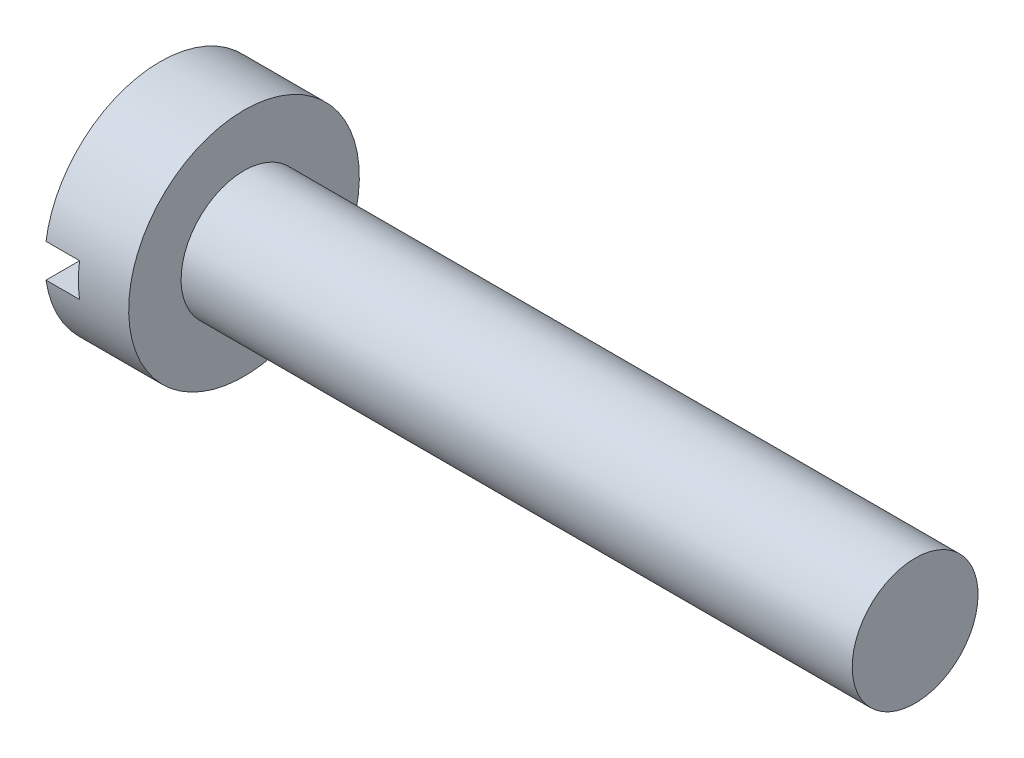
from build123d import *

# Parameters (mm, degrees)
SKETCH2_W          = 5.5
SKETCH2_H          = 0.8
CUT_EXTRUDE1_DEPTH = 0.8


with BuildPart() as part:
    # Sketch1 → Revolve1 (revolve)
    with BuildSketch(Plane.XY):
        Polygon((0, 0), (0, 2.75), (2, 2.75), (2, 1.5), (18, 1.5), (18, 0), align=None)
    revolve(axis=Axis((18, 0, 0), (-1, 0, 0)))

    # Sketch2 → Cut-Extrude1 (cut)
    with BuildSketch(Plane.ZY):
        Rectangle(SKETCH2_W, SKETCH2_H)
    extrude(amount=-CUT_EXTRUDE1_DEPTH, mode=Mode.SUBTRACT)


solid = part.part
